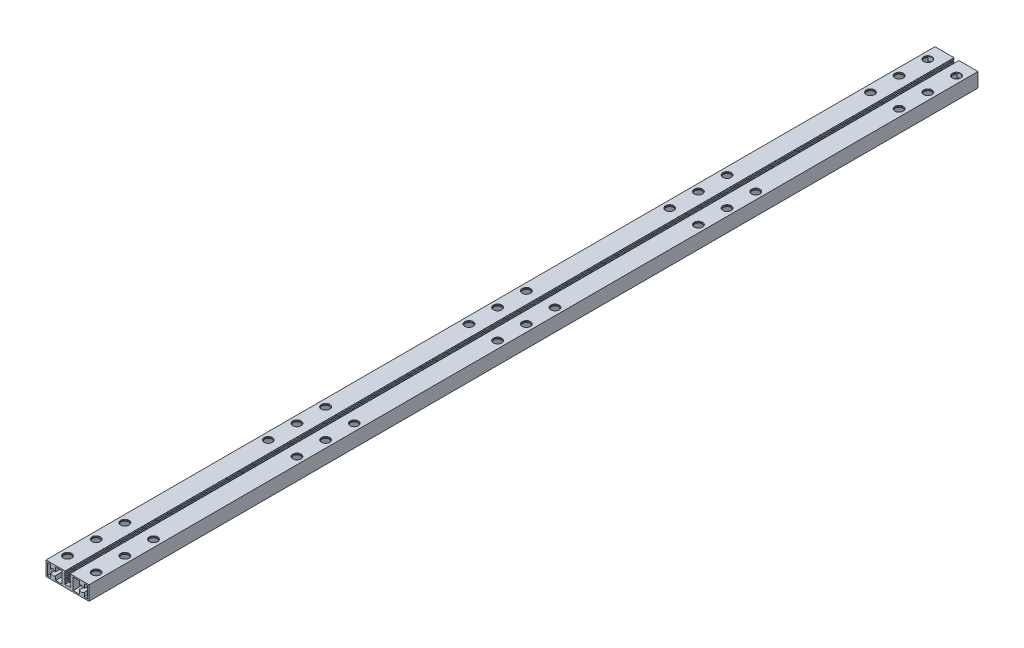
from build123d import *

# Parameters (mm, degrees)
BOSS_EXTRU_1_DEPTH         = 248
ENL_V_MAT_EXTRU_1_DEPTH    = 497.161264107
R_P_TITION_LIN_AIRE1_COUNT = 8
R_P_TITION_LIN_AIRE1_PITCH = 0.8
SYM_TRIE1_COPY_1_DEPTH     = 497.161264107
SYM_TRIE1_COPY_2_DEPTH     = 497.161264107
SYM_TRIE1_COPY_3_DEPTH     = 497.161264107
SYM_TRIE1_COPY_4_DEPTH     = 497.161264107
SYM_TRIE1_COPY_5_DEPTH     = 497.161264107
SYM_TRIE1_COPY_6_DEPTH     = 497.161264107
SYM_TRIE1_COPY_7_DEPTH     = 497.161264107
ESQUISSE3_W                = 8.15
ESQUISSE3_H                = 6.5
ENL_V_MAT_EXTRU_2_DEPTH    = 497.161264107
D_GAGEMENT_M41_AT_2_COUNT  = 2
D_GAGEMENT_M41_AT_2_PITCH  = 16
R_P_TITION_LIN_AIRE2_COUNT = 31
R_P_TITION_LIN_AIRE2_PITCH = 16
BOSS_EXTRU_2_REACH         = 498.161
BOSS_EXTRU_2_END_RADIUS    = 2.1
ESQUISSE6_W                = 2.75
ESQUISSE6_H                = 6.5
BOSS_EXTRU_3_REACH         = 498.161
BOSS_EXTRU_3_END_RADIUS    = 2.1
ESQUISSE9_W                = 2.75
ESQUISSE9_H                = 6.5
TROU_TARAUD_M41_D          = 3.3
BOSS_EXTRU_4_REACH         = 498.161
BOSS_EXTRU_4_END_RADIUS    = 2.1
ESQUISSE10_W               = 2.75
ESQUISSE10_H               = 6.5
BOSS_EXTRU_5_REACH         = 498.161
BOSS_EXTRU_5_END_RADIUS    = 2.1
ESQUISSE11_W               = 2.75
ESQUISSE11_H               = 6.5
TROU_TARAUD_M42_D          = 3.3


with BuildPart() as part:
    # Esquisse1 → Boss.-Extru.1 (new, symmetric)
    with BuildSketch(Plane.XY):
        Polygon((-12, 4), (-1.35, 4), (-1.35, -2.5), (1.35, -2.5), (1.35, 4), (12, 4), (12, -4), (-12, -4), align=None)
    extrude(amount=BOSS_EXTRU_1_DEPTH, both=True)

    # Esquisse2 → Enlèv. mat.-Extru.1 (cut, through all)
    with BuildSketch(Plane.XY.offset(248)):
        Polygon((-1.35, -1.772649731), (-1.35, -2.35), (-1.85, -2.061324865), align=None)
    enl_v_mat_extru_1 = extrude(amount=-ENL_V_MAT_EXTRU_1_DEPTH, mode=Mode.SUBTRACT)

    # Répétition linéaire1: Enlèv. mat.-Extru.1 ×8
    with Locations(*[(0, i * R_P_TITION_LIN_AIRE1_PITCH, 0) for i in range(1, R_P_TITION_LIN_AIRE1_COUNT)]):
        add(enl_v_mat_extru_1, mode=Mode.SUBTRACT)

    # Symétrie1: Enlèv. mat.-Extru.1 across plane
    add(enl_v_mat_extru_1.mirror(Plane(origin=(0, 0, 0), x_dir=(0, 0, 1), z_dir=(1, 0, 0))), mode=Mode.SUBTRACT)

    # Symétrie1 copy 1 sketch → Symétrie1 copy 1 (cut, through all)
    with BuildSketch(Plane(origin=(0, 0.8, 248), x_dir=(-1, 0, 0), z_dir=(0, 0, 1))):
        Polygon((-1.35, 1.772649731), (-1.35, 2.35), (-1.85, 2.061324865), align=None)
    extrude(amount=-SYM_TRIE1_COPY_1_DEPTH, mode=Mode.SUBTRACT)

    # Symétrie1 copy 2 sketch → Symétrie1 copy 2 (cut, through all)
    with BuildSketch(Plane(origin=(0, 1.6, 248), x_dir=(-1, 0, 0), z_dir=(0, 0, 1))):
        Polygon((-1.35, 1.772649731), (-1.35, 2.35), (-1.85, 2.061324865), align=None)
    extrude(amount=-SYM_TRIE1_COPY_2_DEPTH, mode=Mode.SUBTRACT)

    # Symétrie1 copy 3 sketch → Symétrie1 copy 3 (cut, through all)
    with BuildSketch(Plane(origin=(0, 2.4, 248), x_dir=(-1, 0, 0), z_dir=(0, 0, 1))):
        Polygon((-1.35, 1.772649731), (-1.35, 2.35), (-1.85, 2.061324865), align=None)
    extrude(amount=-SYM_TRIE1_COPY_3_DEPTH, mode=Mode.SUBTRACT)

    # Symétrie1 copy 4 sketch → Symétrie1 copy 4 (cut, through all)
    with BuildSketch(Plane(origin=(0, 3.2, 248), x_dir=(-1, 0, 0), z_dir=(0, 0, 1))):
        Polygon((-1.35, 1.772649731), (-1.35, 2.35), (-1.85, 2.061324865), align=None)
    extrude(amount=-SYM_TRIE1_COPY_4_DEPTH, mode=Mode.SUBTRACT)

    # Symétrie1 copy 5 sketch → Symétrie1 copy 5 (cut, through all)
    with BuildSketch(Plane(origin=(0, 4, 248), x_dir=(-1, 0, 0), z_dir=(0, 0, 1))):
        Polygon((-1.35, 1.772649731), (-1.35, 2.35), (-1.85, 2.061324865), align=None)
    extrude(amount=-SYM_TRIE1_COPY_5_DEPTH, mode=Mode.SUBTRACT)

    # Symétrie1 copy 6 sketch → Symétrie1 copy 6 (cut, through all)
    with BuildSketch(Plane(origin=(0, 4.8, 248), x_dir=(-1, 0, 0), z_dir=(0, 0, 1))):
        Polygon((-1.35, 1.772649731), (-1.35, 2.35), (-1.85, 2.061324865), align=None)
    extrude(amount=-SYM_TRIE1_COPY_6_DEPTH, mode=Mode.SUBTRACT)

    # Symétrie1 copy 7 sketch → Symétrie1 copy 7 (cut, through all)
    with BuildSketch(Plane(origin=(0, 5.6, 248), x_dir=(-1, 0, 0), z_dir=(0, 0, 1))):
        Polygon((-1.35, 1.772649731), (-1.35, 2.35), (-1.85, 2.061324865), align=None)
    extrude(amount=-SYM_TRIE1_COPY_7_DEPTH, mode=Mode.SUBTRACT)

    # Esquisse3 → Enlèv. mat.-Extru.2 (cut, through all)
    with BuildSketch(Plane.XY.offset(248)):
        with Locations((-7.175, 0)):
            Rectangle(ESQUISSE3_W, ESQUISSE3_H)
        with Locations((7.175, 0)):
            Rectangle(ESQUISSE3_W, ESQUISSE3_H)
    extrude(amount=-ENL_V_MAT_EXTRU_2_DEPTH, mode=Mode.SUBTRACT)

    # Esquisse4 → Dégagement M41 (revolve, cut)
    with BuildSketch(Plane(origin=(-8, 4, 240), x_dir=(0, 0, 1), z_dir=(1, 0, 0))):
        Polygon((0, 0), (0, 8), (2.35, 8), (2.1, 7.75), (2.1, 0.25), (2.35, 0), align=None)
    d_gagement_m41 = revolve(axis=Axis((-8, 10.35, 240), (0, -1, 0)), mode=Mode.SUBTRACT)

    # Dégagement M41 at 2: Dégagement M41 ×2
    with Locations(*[(i * D_GAGEMENT_M41_AT_2_PITCH, 0, 0) for i in range(1, D_GAGEMENT_M41_AT_2_COUNT)]):
        add(d_gagement_m41, mode=Mode.SUBTRACT)

    # Répétition linéaire2: Dégagement M41 ×31, 16 skipped
    with Locations(*[(0, 0, -i * R_P_TITION_LIN_AIRE2_PITCH) for i in range(1, R_P_TITION_LIN_AIRE2_COUNT) if i not in (3, 4, 5, 6, 10, 11, 12, 13, 17, 18, 19, 20, 24, 25, 26, 27)]):
        add(d_gagement_m41, mode=Mode.SUBTRACT)

    # Répétition linéaire2 copy 1 sketch → Répétition linéaire2 copy 1 (revolve, cut)
    with BuildSketch(Plane(origin=(8, 4, 224), x_dir=(0, 0, 1), z_dir=(1, 0, 0))):
        Polygon((0, 0), (0, 8), (2.35, 8), (2.1, 7.75), (2.1, 0.25), (2.35, 0), align=None)
    revolve(axis=Axis((8, 10.35, 224), (0, -1, 0)), mode=Mode.SUBTRACT)

    # Répétition linéaire2 copy 2 sketch → Répétition linéaire2 copy 2 (revolve, cut)
    with BuildSketch(Plane(origin=(8, 4, 208), x_dir=(0, 0, 1), z_dir=(1, 0, 0))):
        Polygon((0, 0), (0, 8), (2.35, 8), (2.1, 7.75), (2.1, 0.25), (2.35, 0), align=None)
    revolve(axis=Axis((8, 10.35, 208), (0, -1, 0)), mode=Mode.SUBTRACT)

    # Répétition linéaire2 copy 3 sketch → Répétition linéaire2 copy 3 (revolve, cut)
    with BuildSketch(Plane(origin=(8, 4, 128), x_dir=(0, 0, 1), z_dir=(1, 0, 0))):
        Polygon((0, 0), (0, 8), (2.35, 8), (2.1, 7.75), (2.1, 0.25), (2.35, 0), align=None)
    revolve(axis=Axis((8, 10.35, 128), (0, -1, 0)), mode=Mode.SUBTRACT)

    # Répétition linéaire2 copy 4 sketch → Répétition linéaire2 copy 4 (revolve, cut)
    with BuildSketch(Plane(origin=(8, 4, 112), x_dir=(0, 0, 1), z_dir=(1, 0, 0))):
        Polygon((0, 0), (0, 8), (2.35, 8), (2.1, 7.75), (2.1, 0.25), (2.35, 0), align=None)
    revolve(axis=Axis((8, 10.35, 112), (0, -1, 0)), mode=Mode.SUBTRACT)

    # Répétition linéaire2 copy 5 sketch → Répétition linéaire2 copy 5 (revolve, cut)
    with BuildSketch(Plane(origin=(8, 4, 96), x_dir=(0, 0, 1), z_dir=(1, 0, 0))):
        Polygon((0, 0), (0, 8), (2.35, 8), (2.1, 7.75), (2.1, 0.25), (2.35, 0), align=None)
    revolve(axis=Axis((8, 10.35, 96), (0, -1, 0)), mode=Mode.SUBTRACT)

    # Répétition linéaire2 copy 6 sketch → Répétition linéaire2 copy 6 (revolve, cut)
    with BuildSketch(Plane(origin=(8, 4, 16), x_dir=(0, 0, 1), z_dir=(1, 0, 0))):
        Polygon((0, 0), (0, 8), (2.35, 8), (2.1, 7.75), (2.1, 0.25), (2.35, 0), align=None)
    revolve(axis=Axis((8, 10.35, 16), (0, -1, 0)), mode=Mode.SUBTRACT)

    # Répétition linéaire2 copy 7 sketch → Répétition linéaire2 copy 7 (revolve, cut)
    with BuildSketch(Plane(origin=(8, 4, 0), x_dir=(0, 0, 1), z_dir=(1, 0, 0))):
        Polygon((0, 0), (0, 8), (2.35, 8), (2.1, 7.75), (2.1, 0.25), (2.35, 0), align=None)
    revolve(axis=Axis((8, 10.35, 0), (0, -1, 0)), mode=Mode.SUBTRACT)

    # Répétition linéaire2 copy 8 sketch → Répétition linéaire2 copy 8 (revolve, cut)
    with BuildSketch(Plane(origin=(8, 4, -16), x_dir=(0, 0, 1), z_dir=(1, 0, 0))):
        Polygon((0, 0), (0, 8), (2.35, 8), (2.1, 7.75), (2.1, 0.25), (2.35, 0), align=None)
    revolve(axis=Axis((8, 10.35, -16), (0, -1, 0)), mode=Mode.SUBTRACT)

    # Répétition linéaire2 copy 9 sketch → Répétition linéaire2 copy 9 (revolve, cut)
    with BuildSketch(Plane(origin=(8, 4, -96), x_dir=(0, 0, 1), z_dir=(1, 0, 0))):
        Polygon((0, 0), (0, 8), (2.35, 8), (2.1, 7.75), (2.1, 0.25), (2.35, 0), align=None)
    revolve(axis=Axis((8, 10.35, -96), (0, -1, 0)), mode=Mode.SUBTRACT)

    # Répétition linéaire2 copy 10 sketch → Répétition linéaire2 copy 10 (revolve, cut)
    with BuildSketch(Plane(origin=(8, 4, -112), x_dir=(0, 0, 1), z_dir=(1, 0, 0))):
        Polygon((0, 0), (0, 8), (2.35, 8), (2.1, 7.75), (2.1, 0.25), (2.35, 0), align=None)
    revolve(axis=Axis((8, 10.35, -112), (0, -1, 0)), mode=Mode.SUBTRACT)

    # Répétition linéaire2 copy 11 sketch → Répétition linéaire2 copy 11 (revolve, cut)
    with BuildSketch(Plane(origin=(8, 4, -128), x_dir=(0, 0, 1), z_dir=(1, 0, 0))):
        Polygon((0, 0), (0, 8), (2.35, 8), (2.1, 7.75), (2.1, 0.25), (2.35, 0), align=None)
    revolve(axis=Axis((8, 10.35, -128), (0, -1, 0)), mode=Mode.SUBTRACT)

    # Répétition linéaire2 copy 12 sketch → Répétition linéaire2 copy 12 (revolve, cut)
    with BuildSketch(Plane(origin=(8, 4, -208), x_dir=(0, 0, 1), z_dir=(1, 0, 0))):
        Polygon((0, 0), (0, 8), (2.35, 8), (2.1, 7.75), (2.1, 0.25), (2.35, 0), align=None)
    revolve(axis=Axis((8, 10.35, -208), (0, -1, 0)), mode=Mode.SUBTRACT)

    # Répétition linéaire2 copy 13 sketch → Répétition linéaire2 copy 13 (revolve, cut)
    with BuildSketch(Plane(origin=(8, 4, -224), x_dir=(0, 0, 1), z_dir=(1, 0, 0))):
        Polygon((0, 0), (0, 8), (2.35, 8), (2.1, 7.75), (2.1, 0.25), (2.35, 0), align=None)
    revolve(axis=Axis((8, 10.35, -224), (0, -1, 0)), mode=Mode.SUBTRACT)

    # Répétition linéaire2 copy 14 sketch → Répétition linéaire2 copy 14 (revolve, cut)
    with BuildSketch(Plane(origin=(8, 4, -240), x_dir=(0, 0, 1), z_dir=(1, 0, 0))):
        Polygon((0, 0), (0, 8), (2.35, 8), (2.1, 7.75), (2.1, 0.25), (2.35, 0), align=None)
    revolve(axis=Axis((8, 10.35, -240), (0, -1, 0)), mode=Mode.SUBTRACT)

    # Boss.-Extru.2: up to this cylinder (the profile starts outside it)
    boss_extru_2_end = Plane(origin=(-8, 0, 240), z_dir=(0, 1, 0)) * Cylinder(BOSS_EXTRU_2_END_RADIUS, 1001.522, mode=Mode.PRIVATE)
    # Esquisse6 → Boss.-Extru.2 (add, up to the surface)
    with BuildSketch(Plane.XY.offset(248), mode=Mode.PRIVATE) as boss_extru_2_sk1:
        with Locations((-8, 0)):
            Rectangle(ESQUISSE6_W, ESQUISSE6_H)
    boss_extru_2_tool1 = extrude(boss_extru_2_sk1.sketch, amount=-BOSS_EXTRU_2_REACH, mode=Mode.PRIVATE) - boss_extru_2_end
    add(boss_extru_2_tool1.solids().sort_by_distance((-8, 0, 248))[0])

    # Boss.-Extru.3: up to this cylinder (the profile starts outside it)
    boss_extru_3_end = Plane(origin=(8, 0, 240), z_dir=(0, 1, 0)) * Cylinder(BOSS_EXTRU_3_END_RADIUS, 1001.522, mode=Mode.PRIVATE)
    # Esquisse9 → Boss.-Extru.3 (add, up to the surface)
    with BuildSketch(Plane.XY.offset(248), mode=Mode.PRIVATE) as boss_extru_3_sk1:
        with Locations((8, 0)):
            Rectangle(ESQUISSE9_W, ESQUISSE9_H)
    boss_extru_3_tool1 = extrude(boss_extru_3_sk1.sketch, amount=-BOSS_EXTRU_3_REACH, mode=Mode.PRIVATE) - boss_extru_3_end
    add(boss_extru_3_tool1.solids().sort_by_distance((8, 0, 248))[0])

    # Trou taraudé M41 (through all)
    with Locations(Plane.XY.offset(248)):
        with Locations((-8, 0), (8, 0)):
            Hole(TROU_TARAUD_M41_D / 2)

    # Boss.-Extru.4: up to this cylinder (the profile starts outside it)
    boss_extru_4_end = Plane(origin=(8, 0, -240), z_dir=(0, 1, 0)) * Cylinder(BOSS_EXTRU_4_END_RADIUS, 1001.522, mode=Mode.PRIVATE)
    # Esquisse10 → Boss.-Extru.4 (add, up to the surface)
    with BuildSketch(Plane(origin=(0, 0, -248), x_dir=(-1, 0, 0), z_dir=(0, 0, -1)), mode=Mode.PRIVATE) as boss_extru_4_sk1:
        with Locations((-8, 0)):
            Rectangle(ESQUISSE10_W, ESQUISSE10_H)
    boss_extru_4_tool1 = extrude(boss_extru_4_sk1.sketch, amount=-BOSS_EXTRU_4_REACH, mode=Mode.PRIVATE) - boss_extru_4_end
    add(boss_extru_4_tool1.solids().sort_by_distance((8, 0, -248))[0])

    # Boss.-Extru.5: up to this cylinder (the profile starts outside it)
    boss_extru_5_end = Plane(origin=(-8, 0, -240), z_dir=(0, 1, 0)) * Cylinder(BOSS_EXTRU_5_END_RADIUS, 1001.522, mode=Mode.PRIVATE)
    # Esquisse11 → Boss.-Extru.5 (add, up to the surface)
    with BuildSketch(Plane(origin=(0, 0, -248), x_dir=(-1, 0, 0), z_dir=(0, 0, -1)), mode=Mode.PRIVATE) as boss_extru_5_sk1:
        with Locations((8, 0)):
            Rectangle(ESQUISSE11_W, ESQUISSE11_H)
    boss_extru_5_tool1 = extrude(boss_extru_5_sk1.sketch, amount=-BOSS_EXTRU_5_REACH, mode=Mode.PRIVATE) - boss_extru_5_end
    add(boss_extru_5_tool1.solids().sort_by_distance((-8, 0, -248))[0])

    # Trou taraudé M42 (through all)
    with Locations(Plane(origin=(0, 0, -248), x_dir=(-1, 0, 0), z_dir=(0, 0, -1))):
        with Locations((-8, 0), (8, 0)):
            Hole(TROU_TARAUD_M42_D / 2)


solid = part.part
